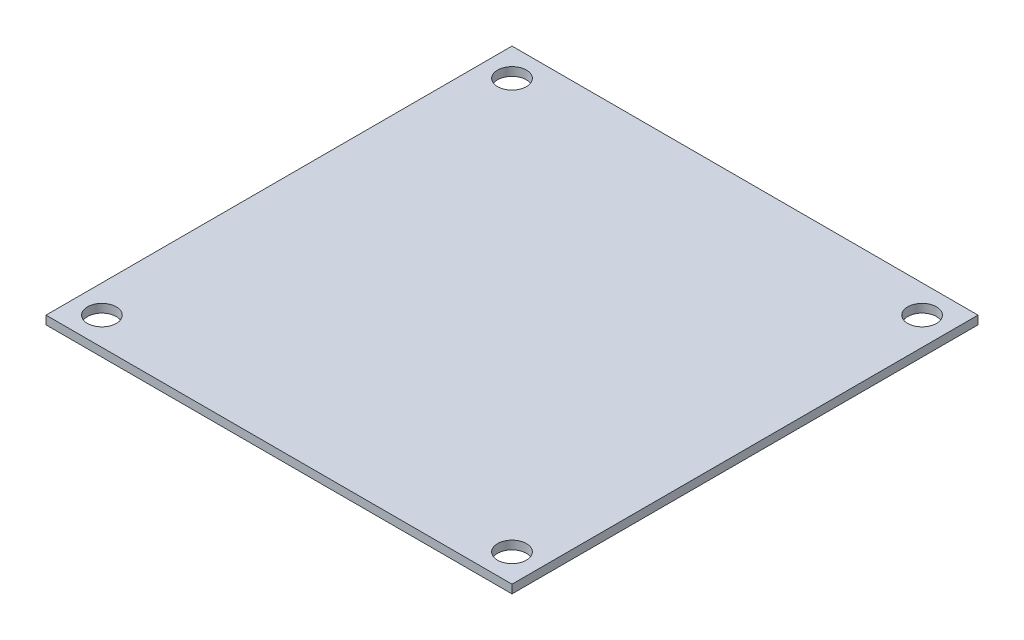
from build123d import *

# Parameters (mm, degrees)
SKETCH1_W           = 55
SKETCH1_H           = 55
BOSS_EXTRUDE1_DEPTH = 0.5
SKETCH2_R           = 1.7
CUT_EXTRUDE1_DEPTH  = 39.903727328


with BuildPart() as part:
    # Sketch1 → Boss-Extrude1 (new, symmetric)
    with BuildSketch(Plane(origin=(0, 0, 0), x_dir=(1, 0, 0), z_dir=(0, 1, 0))):
        Rectangle(SKETCH1_W, SKETCH1_H)
    extrude(amount=BOSS_EXTRUDE1_DEPTH, both=True)

    # Sketch2 → Cut-Extrude1 (cut, through all)
    with BuildSketch(Plane(origin=(0, 0.5, 0), x_dir=(1, 0, 0), z_dir=(0, 1, 0))):
        with Locations(Location((-24.2, 24.2, 0), (0, 0, 270))):
            Circle(SKETCH2_R)
        with Locations(Location((24.2, 24.2, 0), (0, 0, 270))):
            Circle(SKETCH2_R)
        with Locations(Location((-24.2, -24.2, 0), (0, 0, 270))):
            Circle(SKETCH2_R)
        with Locations(Location((24.2, -24.2, 0), (0, 0, 270))):
            Circle(SKETCH2_R)
    extrude(amount=-CUT_EXTRUDE1_DEPTH, mode=Mode.SUBTRACT)


solid = part.part
